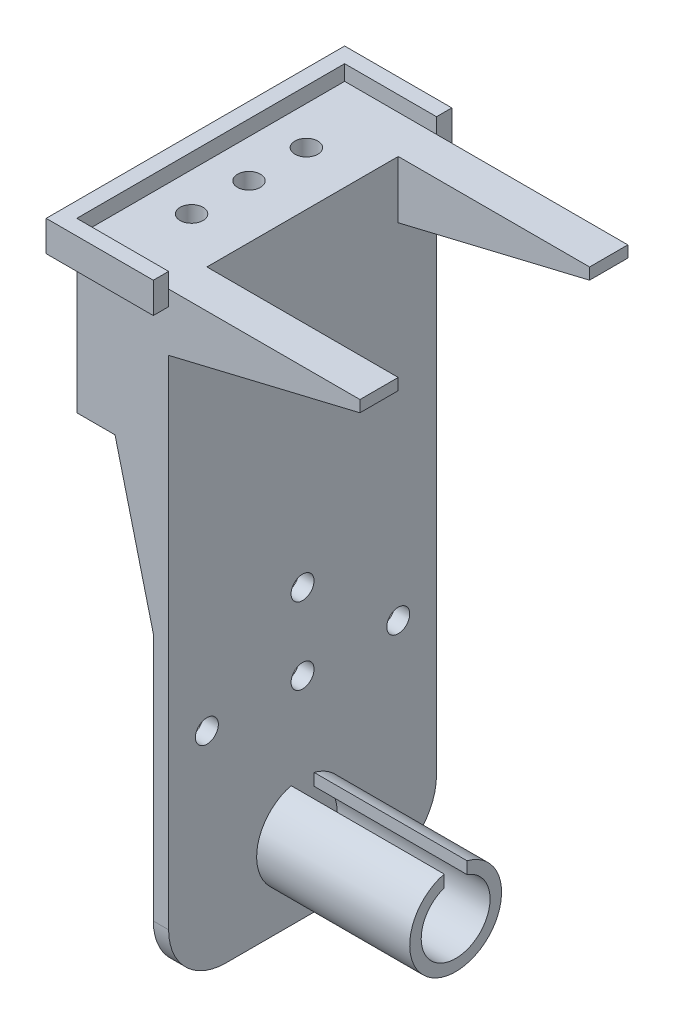
from build123d import *

# Parameters (mm, degrees)
SALIENTE_EXTRUIR1_DEPTH      = 40
SALIENTE_EXTRUIR2_DEPTH      = 4
CROQUIS3_R                   = 3
CORTAR_EXTRUIR1_DEPTH        = 4
CROQUIS4_R                   = 6
CORTAR_EXTRUIR2_DEPTH        = 1
SALIENTE_EXTRUIR3_DEPTH      = 40
SALIENTE_EXTRUIR4_START      = 25
SALIENTE_EXTRUIR4_DEPTH      = 10
SALIENTE_EXTRUIR5_START      = -25
SALIENTE_EXTRUIR5_DEPTH      = 10
SALIENTE_EXTRUIR6_DEPTH      = 4
SALIENTE_EXTRUIR6_DEPTH_BACK = 4
SALIENTE_EXTRUIR6_START      = 140
SALIENTE_EXTRUIR7_START      = 31
SALIENTE_EXTRUIR7_DEPTH      = 4
SALIENTE_EXTRUIR8_START      = -31
SALIENTE_EXTRUIR8_DEPTH      = 4
CORTAR_EXTRUIR3_DEPTH        = 4
CORTAR_EXTRUIR4_DEPTH        = 4
CROQUIS22_R                  = 3
CORTAR_EXTRUIR5_DEPTH        = 4


with BuildPart() as part:
    # Croquis1 → Saliente-Extruir1 (new body)
    with BuildSketch(Plane(origin=(0, 0, 0), x_dir=(0, 0, -1), z_dir=(1, 0, 0))):
        with BuildLine():
            Line((3, 9), (3, 11.618950039))
            ThreePointArc((3, 11.618950039), (0, -12), (-3, 11.618950039))
            Line((-3, 11.618950039), (-3, 9))
            Line((-3, 9), (-3, 8.485281374))
            ThreePointArc((-3, 8.485281374), (0, -9), (3, 8.485281374))
            Line((3, 8.485281374), (3, 9))
        make_face()
    extrude(amount=SALIENTE_EXTRUIR1_DEPTH)

    # Croquis2 → Saliente-Extruir2 (add)
    with BuildSketch(Plane.ZY):
        Polygon((-35, 0), (-35, 140), (35, 140), (35, 0), (35, -20), (-35, -20), align=None)
    extrude(amount=SALIENTE_EXTRUIR2_DEPTH)

    # Croquis3 → Cortar-Extruir1 (cut)
    with BuildSketch(Plane(origin=(0, 0, 0), x_dir=(0, 0, -1), z_dir=(1, 0, 0))):
        Circle(CROQUIS3_R)
    extrude(amount=-CORTAR_EXTRUIR1_DEPTH, mode=Mode.SUBTRACT)

    # Croquis4 → Cortar-Extruir2 (cut)
    with BuildSketch(Plane.ZY.offset(4)):
        Circle(CROQUIS4_R)
    extrude(amount=-CORTAR_EXTRUIR2_DEPTH, mode=Mode.SUBTRACT)

    # Croquis6 → Saliente-Extruir3 (add)
    with BuildSketch(Plane(origin=(0, 140, 0), x_dir=(1, 0, 0), z_dir=(0, 1, 0))):
        with BuildLine():
            Line((-14, 30), (-14, 35))
            Line((-14, 35), (-24, 35))
            Line((-24, 35), (-24, -35))
            Line((-24, -35), (-14, -35))
            Line((-14, -35), (-14, -30))
            Line((-14, -30), (-14, -18))
            ThreePointArc((-14, -18), (-17, -15), (-14, -12))
            Line((-14, -12), (-14, -3))
            ThreePointArc((-14, -3), (-17, 0), (-14, 3))
            Line((-14, 3), (-14, 12))
            ThreePointArc((-14, 12), (-17, 15), (-14, 18))
            Line((-14, 18), (-14, 30))
        make_face()
        with BuildLine():
            Line((-4, 35), (-14, 35))
            Line((-14, 35), (-14, 30))
            Line((-14, 30), (-14, 18))
            ThreePointArc((-14, 18), (-11.878679656, 17.121320344), (-11, 15))
            ThreePointArc((-11, 15), (-11.878679656, 12.878679656), (-14, 12))
            Line((-14, 12), (-14, 3))
            ThreePointArc((-14, 3), (-11.878679656, 2.121320344), (-11, 0))
            ThreePointArc((-11, 0), (-11.878679656, -2.121320344), (-14, -3))
            Line((-14, -3), (-14, -12))
            ThreePointArc((-14, -12), (-11.878679656, -12.878679656), (-11, -15))
            ThreePointArc((-11, -15), (-11.878679656, -17.121320344), (-14, -18))
            Line((-14, -18), (-14, -30))
            Line((-14, -30), (-14, -35))
            Line((-14, -35), (-4, -35))
            Line((-4, -35), (-4, 35))
        make_face()
    extrude(amount=-SALIENTE_EXTRUIR3_DEPTH)

    # Croquis7 → Saliente-Extruir4 (add)
    with BuildSketch(Plane.XY.offset(SALIENTE_EXTRUIR4_START)):
        Polygon((0, 140), (50, 140), (50, 137), (0, 125), align=None)
    extrude(amount=SALIENTE_EXTRUIR4_DEPTH)

    # Croquis8 → Saliente-Extruir5 (add)
    with BuildSketch(Plane.XY.offset(SALIENTE_EXTRUIR5_START)):
        Polygon((0, 140), (50, 140), (50, 137), (0, 125), align=None)
    extrude(amount=-SALIENTE_EXTRUIR5_DEPTH)

    # Croquis9 → Saliente-Extruir6 (add, two sides: drawn at the far end of the back side and taken through both)
    with BuildSketch(Plane(origin=(0, 0, 0), x_dir=(1, 0, 0), z_dir=(0, 1, 0)).offset(SALIENTE_EXTRUIR6_START - SALIENTE_EXTRUIR6_DEPTH_BACK)):
        Polygon((0, 35), (0, 39), (-28, 39), (-28, -39), (-24, -39), (0, -39), (0, -35), (-24, -35), (-24, 35), align=None)
    extrude(amount=SALIENTE_EXTRUIR6_DEPTH + SALIENTE_EXTRUIR6_DEPTH_BACK)

    # Croquis16 → Saliente-Extruir7 (add)
    with BuildSketch(Plane.XY.offset(SALIENTE_EXTRUIR7_START)):
        Polygon((-14, 100), (-4, 60), (-4, 100), align=None)
    extrude(amount=SALIENTE_EXTRUIR7_DEPTH)

    # Croquis17 → Saliente-Extruir8 (add)
    with BuildSketch(Plane.XY.offset(SALIENTE_EXTRUIR8_START)):
        Polygon((-4, 100), (-14, 100), (-4, 60), align=None)
    extrude(amount=-SALIENTE_EXTRUIR8_DEPTH)

    # Croquis19 → Cortar-Extruir3 (cut)
    with BuildSketch(Plane.ZY.offset(4)):
        with BuildLine():
            Line((-35, -20), (-20, -20))
            ThreePointArc((-20, -20), (-30.606601718, -15.606601718), (-35, -5))
            Line((-35, -5), (-35, -20))
        make_face()
        with BuildLine():
            Line((35, -20), (20, -20))
            ThreePointArc((20, -20), (30.606601718, -15.606601718), (35, -5))
            Line((35, -5), (35, -20))
        make_face()
    extrude(amount=-CORTAR_EXTRUIR3_DEPTH, mode=Mode.SUBTRACT)

    # Croquis20 → Cortar-Extruir4 (cut)
    with BuildSketch(Plane.ZY.offset(4)):
        with BuildLine():
            ThreePointArc((-22, 35), (-25, 38), (-28, 35))
            Line((-28, 35), (-22, 35))
        make_face()
        with BuildLine():
            Line((-22, 35), (-28, 35))
            ThreePointArc((-28, 35), (-25, 32), (-22, 35))
        make_face()
        with BuildLine():
            ThreePointArc((3, 35), (0, 38), (-3, 35))
            Line((-3, 35), (3, 35))
        make_face()
        with BuildLine():
            Line((3, 35), (-3, 35))
            ThreePointArc((-3, 35), (0, 32), (3, 35))
        make_face()
        with BuildLine():
            ThreePointArc((22, 35), (25, 32), (28, 35))
            Line((28, 35), (22, 35))
        make_face()
        with BuildLine():
            Line((22, 35), (28, 35))
            ThreePointArc((28, 35), (25, 38), (22, 35))
        make_face()
    extrude(amount=-CORTAR_EXTRUIR4_DEPTH, mode=Mode.SUBTRACT)

    # Croquis22 → Cortar-Extruir5 (cut)
    with BuildSketch(Plane.ZY.offset(4)):
        with Locations((0, 55)):
            Circle(CROQUIS22_R)
    extrude(amount=-CORTAR_EXTRUIR5_DEPTH, mode=Mode.SUBTRACT)


solid = part.part
